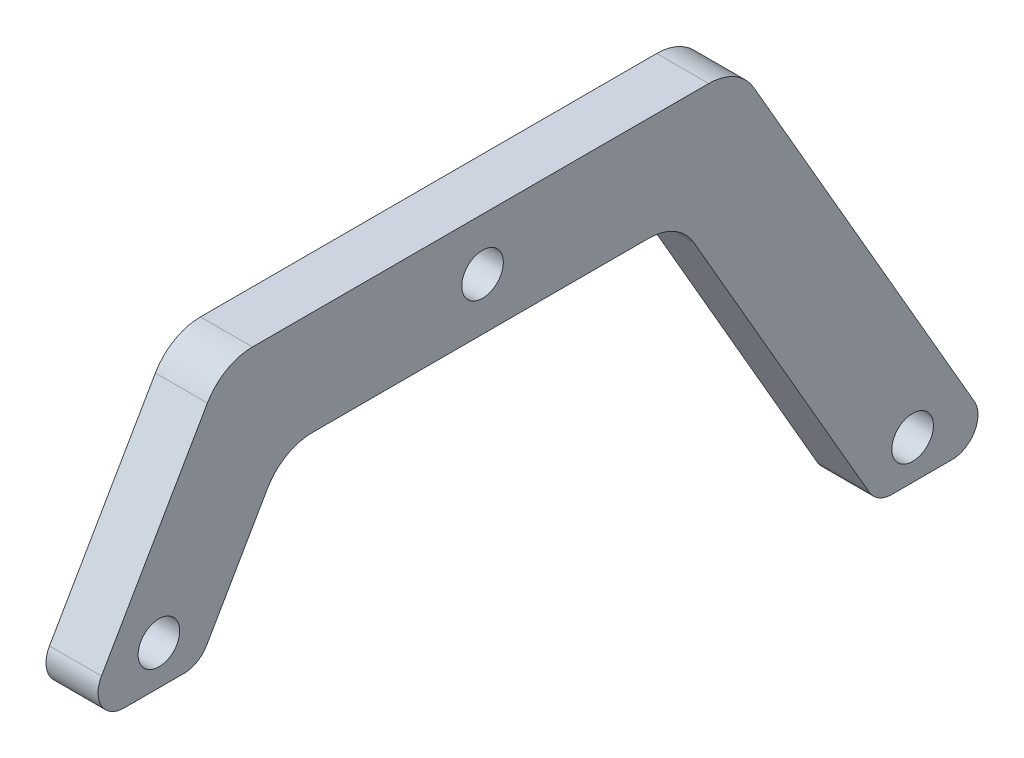
from build123d import *

# Parameters (mm, degrees)
SKETCH1_R           = 8
BOSS_EXTRUDE1_DEPTH = 20


with BuildPart() as part:
    # Sketch1 → Boss-Extrude1 (new body)
    with BuildSketch(Plane(origin=(0, 0, 0), x_dir=(0, 0, -1), z_dir=(1, 0, 0))):
        with BuildLine():
            Line((-119.178374201, 67.052249248), (-78.462130931, 137.574851286))
            ThreePointArc((-78.462130931, 137.574851286), (-71.141622855, 144.895359362), (-61.141622855, 147.574851286))
            Line((-61.141622855, 147.574851286), (114.228325361, 147.574851286))
            ThreePointArc((114.228325361, 147.574851286), (124.228325361, 144.895359362), (131.548833436, 137.574851286))
            Line((131.548833436, 137.574851286), (216.415076707, -9.417793906))
            ThreePointArc((216.415076707, -9.417793906), (216.415076707, -19.417793906), (207.754822669, -24.417793906))
            Line((207.754822669, -24.417793906), (184.660811901, -24.417793906))
            ThreePointArc((184.660811901, -24.417793906), (179.660811901, -23.078047944), (176.000557863, -19.417793906))
            Line((176.000557863, -19.417793906), (108.454822669, 97.574851286))
            ThreePointArc((108.454822669, 97.574851286), (101.134314593, 104.895359362), (91.134314593, 107.574851286))
            Line((91.134314593, 107.574851286), (-38.047612088, 107.574851286))
            ThreePointArc((-38.047612088, 107.574851286), (-48.047612088, 104.895359362), (-55.368120164, 97.574851286))
            Line((-55.368120164, 97.574851286), (-78.763855358, 57.052249248))
            ThreePointArc((-78.763855358, 57.052249248), (-82.424109396, 53.391995211), (-87.424109396, 52.052249248))
            Line((-87.424109396, 52.052249248), (-110.518120164, 52.052249248))
            ThreePointArc((-110.518120164, 52.052249248), (-119.178374201, 57.052249248), (-119.178374201, 67.052249248))
        make_face()
        with Locations((27.29341652, 127.574851286)):
            Circle(SKETCH1_R, mode=Mode.SUBTRACT)
        with Locations((-97.100927569, 67.052249248)):
            Circle(SKETCH1_R, mode=Mode.SUBTRACT)
        with Locations((192.620942212, -9.417793906)):
            Circle(SKETCH1_R, mode=Mode.SUBTRACT)
    extrude(amount=BOSS_EXTRUDE1_DEPTH)


solid = part.part
